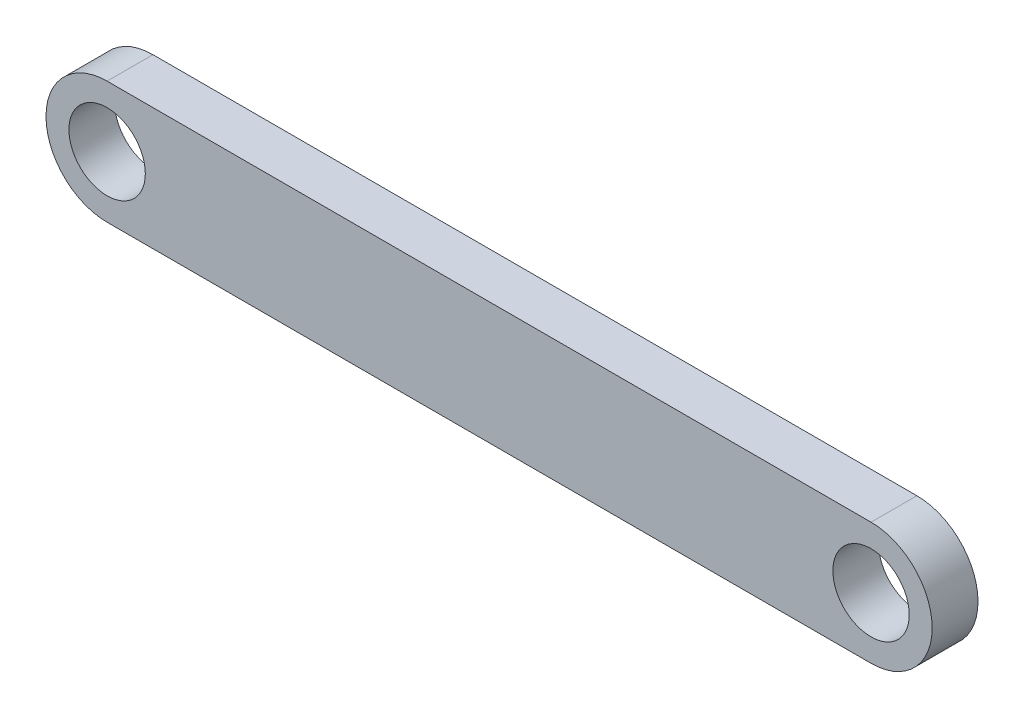
from build123d import *

# Parameters (mm, degrees)
SKETCH2_R           = 2.5
BOSS_EXTRUDE1_DEPTH = 3


with BuildPart() as part:
    # Sketch2 → Boss-Extrude1 (new body)
    with BuildSketch(Plane.XY):
        with BuildLine():
            Line((-50, 4), (0, 4))
            ThreePointArc((0, 4), (4, 0), (0, -4))
            Line((0, -4), (-50, -4))
            ThreePointArc((-50, -4), (-54, 0), (-50, 4))
        make_face()
        with Locations((-50, 0)):
            Circle(SKETCH2_R, mode=Mode.SUBTRACT)
        Circle(SKETCH2_R, mode=Mode.SUBTRACT)
    extrude(amount=BOSS_EXTRUDE1_DEPTH)


solid = part.part
